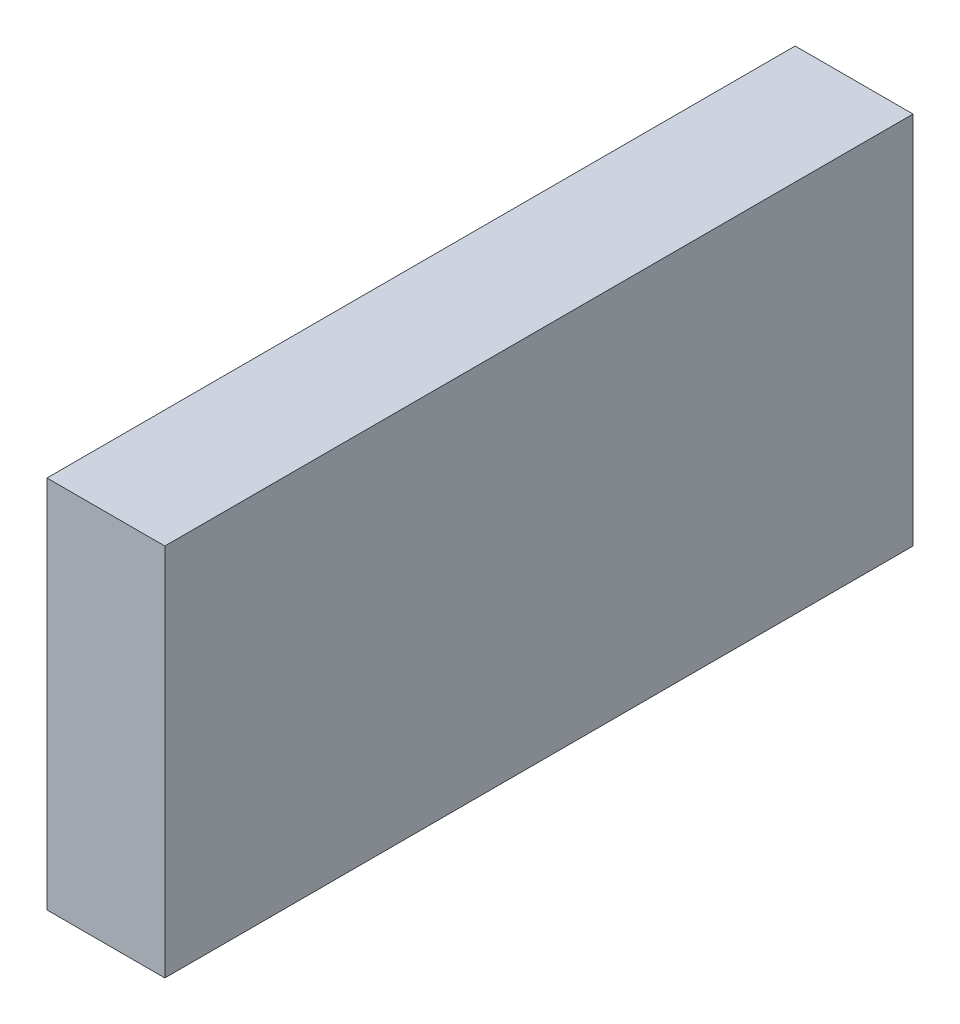
from build123d import *

# Parameters (mm, degrees)
SKETCH1_W           = 40
SKETCH1_H           = 20
BOSS_EXTRUDE1_DEPTH = 6.3


with BuildPart() as part:
    # Sketch1 → Boss-Extrude1 (new body)
    with BuildSketch(Plane(origin=(0, 0, 0), x_dir=(0, 0, -1), z_dir=(1, 0, 0))):
        with Locations((20, 10)):
            Rectangle(SKETCH1_W, SKETCH1_H)
    extrude(amount=-BOSS_EXTRUDE1_DEPTH)


solid = part.part
